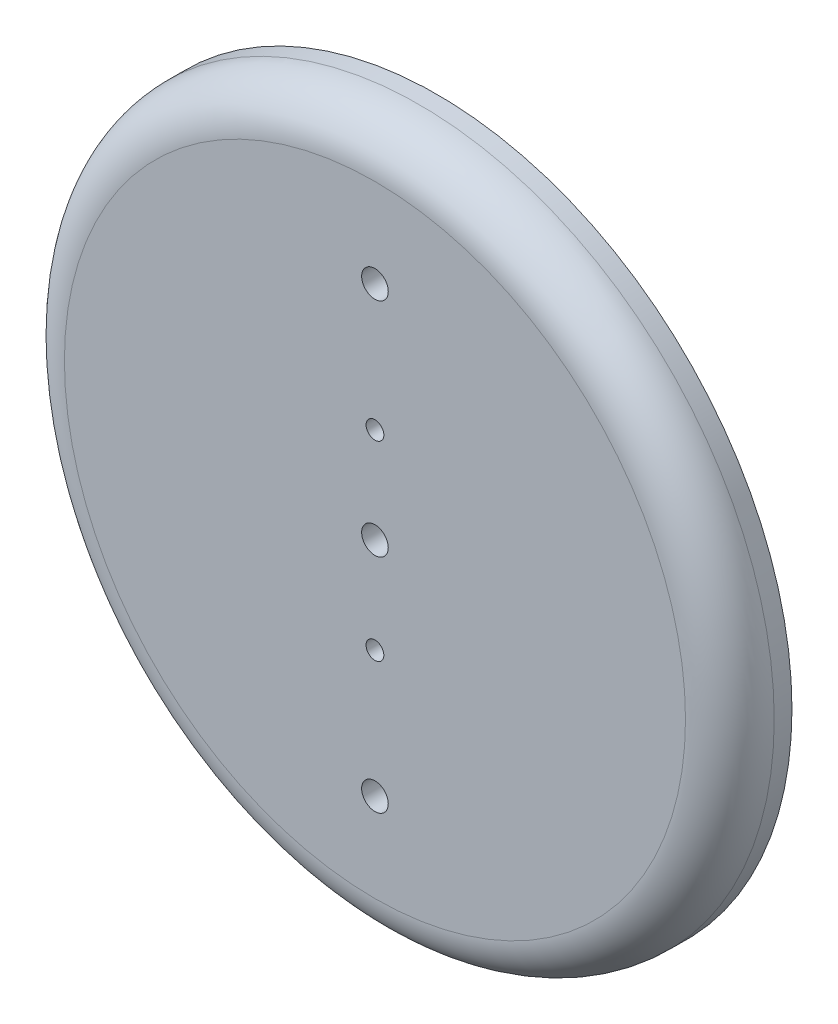
from build123d import *

# Parameters (mm, degrees)
SCHIZZO1_R                   = 40
ESTRUSIONE_ESTRUSIONE1_DEPTH = 7
RACCORDO1_R                  = 5
SCHIZZO2_R                   = 1.5
TAGLIO_ESTRUSIONE1_DEPTH     = 37
SCHIZZO3_R                   = 1
TAGLIO_ESTRUSIONE2_DEPTH     = 10
SCHIZZO4_R                   = 1.5
TAGLIO_ESTRUSIONE3_DEPTH     = 10


with BuildPart() as part:
    # Schizzo1 → Estrusione-Estrusione1 (new body)
    with BuildSketch(Plane.XY):
        Circle(SCHIZZO1_R)
    extrude(amount=ESTRUSIONE_ESTRUSIONE1_DEPTH)

    # Raccordo1
    raccordo1_edges = [part.edges().sort_by_distance(p)[0] for p in [
        (-40, 0, 7),
    ]]
    fillet(raccordo1_edges, radius=RACCORDO1_R)

    # Schizzo2 → Taglio-Estrusione1 (cut)
    with BuildSketch(Plane.XY.offset(7)):
        with Locations((0, 25)):
            Circle(SCHIZZO2_R)
        with Locations((0, -25)):
            Circle(SCHIZZO2_R)
    extrude(amount=-TAGLIO_ESTRUSIONE1_DEPTH, mode=Mode.SUBTRACT)

    # Schizzo3 → Taglio-Estrusione2 (cut)
    with BuildSketch(Plane.XY.offset(7)):
        with Locations((0, 10.75)):
            Circle(SCHIZZO3_R)
        with Locations((0, -10.75)):
            Circle(SCHIZZO3_R)
    extrude(amount=-TAGLIO_ESTRUSIONE2_DEPTH, mode=Mode.SUBTRACT)

    # Schizzo4 → Taglio-Estrusione3 (cut)
    with BuildSketch(Plane.XY.offset(7)):
        Circle(SCHIZZO4_R)
    extrude(amount=-TAGLIO_ESTRUSIONE3_DEPTH, mode=Mode.SUBTRACT)


solid = part.part
